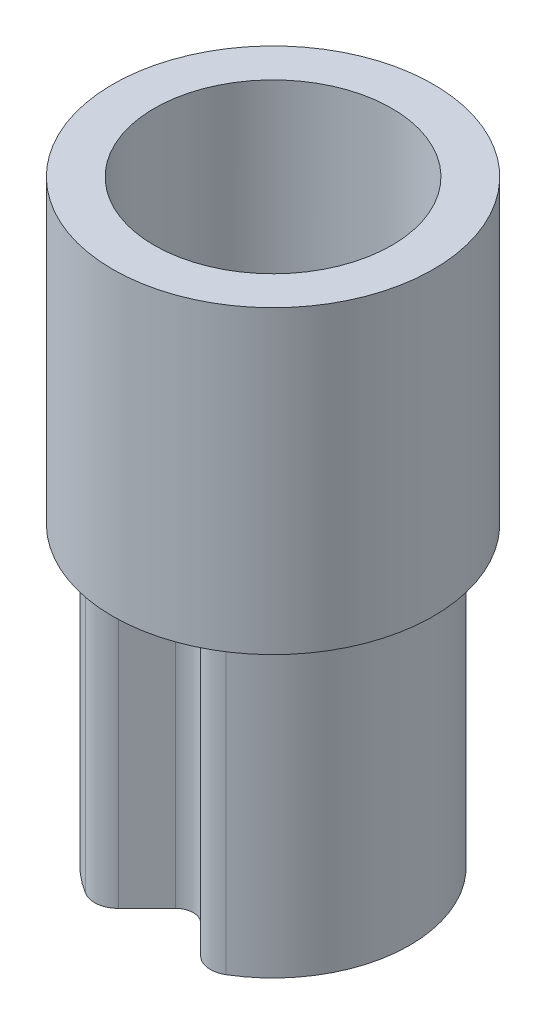
from build123d import *

# Parameters (mm, degrees)
BOSS_EXTRUDE1_DEPTH = 2.5
FILLET1_R           = 0.05
FILLET2_R           = 0.2
SKETCH2_R           = 1.35
SKETCH2_R_2         = 1
BOSS_EXTRUDE2_DEPTH = 2.53


with BuildPart() as part:
    # Sketch1 → Boss-Extrude1 (new body)
    with BuildSketch(Plane(origin=(0, 0, 0), x_dir=(1, 0, 0), z_dir=(0, 1, 0))):
        with BuildLine():
            Line((-0.448807004, -1.058807004), (-0.106066017, -0.716066017))
            ThreePointArc((-0.106066017, -0.716066017), (0, -0.672132034), (0.106066017, -0.716066017))
            Line((0.106066017, -0.716066017), (0.448807004, -1.058807004))
            ThreePointArc((0.448807004, -1.058807004), (0, 1.15), (-0.448807004, -1.058807004))
        make_face()
        with BuildLine():
            Line((-0.479612457, -0.877480422), (-0.212132034, -0.61))
            ThreePointArc((-0.212132034, -0.61), (0, -0.522132034), (0.212132034, -0.61))
            Line((0.212132034, -0.61), (0.479612457, -0.877480422))
            ThreePointArc((0.479612457, -0.877480422), (0, 1), (-0.479612457, -0.877480422))
        make_face(mode=Mode.SUBTRACT)
    extrude(amount=BOSS_EXTRUDE1_DEPTH)

    # Fillet1
    fillet1_edges = [part.edges().sort_by_distance(p)[0] for p in [
        (0.479612457, 1.25, 0.877480422),
        (-0.479612457, 1.25, 0.877480422),
    ]]
    fillet(fillet1_edges, radius=FILLET1_R)

    # Fillet2
    fillet2_edges = [part.edges().sort_by_distance(p)[0] for p in [
        (-0.448807004, 1.25, 1.058807004),
        (0.448807004, 1.25, 1.058807004),
    ]]
    fillet(fillet2_edges, radius=FILLET2_R)

    # Sketch2 → Boss-Extrude2 (add)
    with BuildSketch(Plane(origin=(0, 2.5, 0), x_dir=(1, 0, 0), z_dir=(0, 1, 0))):
        with Locations(Location((0, 0, 0), (0, 0, 270))):
            Circle(SKETCH2_R)
        with Locations(Location((0, 0, 0), (0, 0, 239.09383603))):
            Circle(SKETCH2_R_2, mode=Mode.SUBTRACT)
    extrude(amount=BOSS_EXTRUDE2_DEPTH)


solid = part.part
